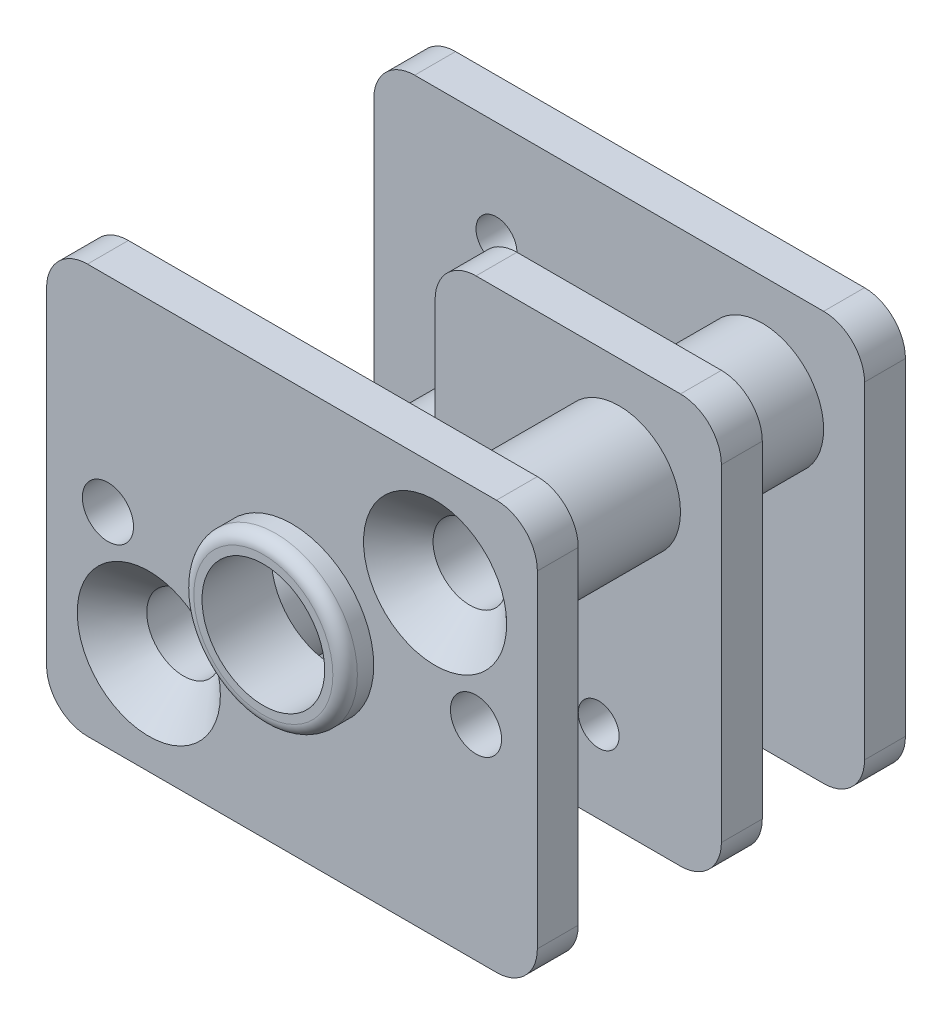
from build123d import *

# Parameters (mm, degrees)
SKETCH_1_W               = 12
SKETCH_1_H               = 10
SKETCH_1_R               = 1.5
EXTRUDE_1_DEPTH          = 1
SKETCH_4_R               = 1.5
SKETCH_4_R_2             = 0.9
EXTRUDE_2_DEPTH          = 3.5
SKETCH_5_R               = 0.5
EXTRUDE_3_DEPTH          = 1
SKETCH_6_R               = 1.5
SKETCH_6_R_2             = 0.9
EXTRUDE_4_DEPTH          = 2.5
SKETCH_7_W               = 12
SKETCH_7_H               = 10
SKETCH_7_R               = 0.532937176
SKETCH_7_R_2             = 0.5
EXTRUDE_5_DEPTH          = 1
FILLET_1_R               = 1
HOLE_WIZARD_1_AT_2_COUNT = 2
HOLE_WIZARD_1_AT_2_PITCH = 8.602325267
HOLE_WIZARD_M1_6_1_D     = 1.25
HOLE_WIZARD_M1_6_1_DEPTH = 1
SKETCH_12_R              = 2
SKETCH_12_R_2            = 1.5
EXTRUDE_6_DEPTH          = 0.7
FILLET_2_R               = 0.3


with BuildPart() as part:
    # 草图1 → 凸台-拉伸1 (new body)
    with BuildSketch(Plane.XY):
        Rectangle(SKETCH_1_W, SKETCH_1_H)
        Circle(SKETCH_1_R, mode=Mode.SUBTRACT)
    extrude(amount=EXTRUDE_1_DEPTH)

    # 草图4 → 凸台-拉伸2 (add)
    # profile 1 of 2: a face of its own
    with BuildSketch(Plane(origin=(0, 0, 0), x_dir=(-1, 0, 0), z_dir=(0, 0, -1))):
        with Locations(Location((-3.5, 2.5, 0), (0, 0, 180))):
            Circle(SKETCH_4_R)
        with Locations((-3.5, 2.5)):
            Circle(SKETCH_4_R_2, mode=Mode.SUBTRACT)
    # profile 2 of 2: a face of its own
    with BuildSketch(Plane(origin=(0, 0, 0), x_dir=(-1, 0, 0), z_dir=(0, 0, -1))):
        with Locations(Location((3.5, -2.5, 0), (0, 0, 180))):
            Circle(SKETCH_4_R)
        with Locations((3.5, -2.5)):
            Circle(SKETCH_4_R_2, mode=Mode.SUBTRACT)
    extrude(amount=EXTRUDE_2_DEPTH)

    # 草图5 → 凸台-拉伸3 (add)
    with BuildSketch(Plane(origin=(0, 0, -3.5), x_dir=(-1, 0, 0), z_dir=(0, 0, -1))):
        Polygon((-6, -5), (-6, 5), (1, 5), (1, 0), (6, 0), (6, -5), align=None)
        with Locations((-3, -3)):
            Circle(SKETCH_5_R, mode=Mode.SUBTRACT)
        Circle(SKETCH_5_R, mode=Mode.SUBTRACT)
    extrude(amount=EXTRUDE_3_DEPTH)

    # 草图6 → 凸台-拉伸4 (add)
    # profile 1 of 2: a face of its own
    with BuildSketch(Plane(origin=(0, 0, -4.5), x_dir=(-1, 0, 0), z_dir=(0, 0, -1))):
        with Locations(Location((3.5, -2.5, 0), (0, 0, 180))):
            Circle(SKETCH_6_R)
        with Locations((3.5, -2.5)):
            Circle(SKETCH_6_R_2, mode=Mode.SUBTRACT)
    # profile 2 of 2: a face of its own
    with BuildSketch(Plane(origin=(0, 0, -4.5), x_dir=(-1, 0, 0), z_dir=(0, 0, -1))):
        with Locations(Location((-3.5, 2.5, 0), (0, 0, 180))):
            Circle(SKETCH_6_R)
        with Locations((-3.5, 2.5)):
            Circle(SKETCH_6_R_2, mode=Mode.SUBTRACT)
    extrude(amount=EXTRUDE_4_DEPTH)

    # 草图7 → 凸台-拉伸5 (add)
    with BuildSketch(Plane(origin=(0, 0, -7), x_dir=(-1, 0, 0), z_dir=(0, 0, -1))):
        Rectangle(SKETCH_7_W, SKETCH_7_H)
        Circle(SKETCH_7_R, mode=Mode.SUBTRACT)
        with Locations((3, 2.5)):
            Circle(SKETCH_7_R_2, mode=Mode.SUBTRACT)
    extrude(amount=EXTRUDE_5_DEPTH)

    # 圆角1
    fillet_1_edges = [part.edges().sort_by_distance(p)[0] for p in [
        (6, -5, -4),
        (-6, -5, -4),
        (-6, 0, -4),
        (-1, 0, -4),
        (-1, 5, -4),
        (6, 5, -4),
        (-6, 5, -7.5),
        (6, 5, -7.5),
        (6, -5, -7.5),
        (-6, -5, -7.5),
        (6, -5, 0.5),
        (-6, -5, 0.5),
        (-6, 5, 0.5),
        (6, 5, 0.5),
    ]]
    fillet(fillet_1_edges, radius=FILLET_1_R)

    # 草图8 → 打孔尺寸根据开槽半沉头木螺钉的类型1 (revolve, cut)
    with BuildSketch(Plane(origin=(3.5, 2.5, 1), x_dir=(0, -1, 0), z_dir=(1, 0, 0))):
        Polygon((0, 0), (0, 1), (0.9, 1), (0.9, 0.85), (1.75, 0), align=None)
    hole_wizard_1 = revolve(axis=Axis((3.5, 2.5, 7.35), (0, 0, -1)), mode=Mode.SUBTRACT)

    # 打孔尺寸根据开槽半沉头木螺钉的类型1 at 2: 打孔尺寸根据开槽半沉头木螺钉的类型1 ×2
    with Locations(*[Vector(-0.813733471206731, -0.5812381937191019, 0) * (i * HOLE_WIZARD_1_AT_2_PITCH) for i in range(1, HOLE_WIZARD_1_AT_2_COUNT)]):
        add(hole_wizard_1, mode=Mode.SUBTRACT)

    # M1.6 螺纹孔1
    with Locations(Plane.XY.offset(1)):
        with Locations((4.5, 0), (-4.5, 0)):
            Hole(HOLE_WIZARD_M1_6_1_D / 2, depth=HOLE_WIZARD_M1_6_1_DEPTH)

    # 草图12 → 凸台-拉伸6 (add)
    with BuildSketch(Plane.XY.offset(1)):
        Circle(SKETCH_12_R)
        Circle(SKETCH_12_R_2, mode=Mode.SUBTRACT)
    extrude(amount=EXTRUDE_6_DEPTH)

    # 圆角2
    fillet_2_edges = [part.edges().sort_by_distance(p)[0] for p in [
        (-2, 0, 1.7),
    ]]
    fillet(fillet_2_edges, radius=FILLET_2_R)


solid = part.part
